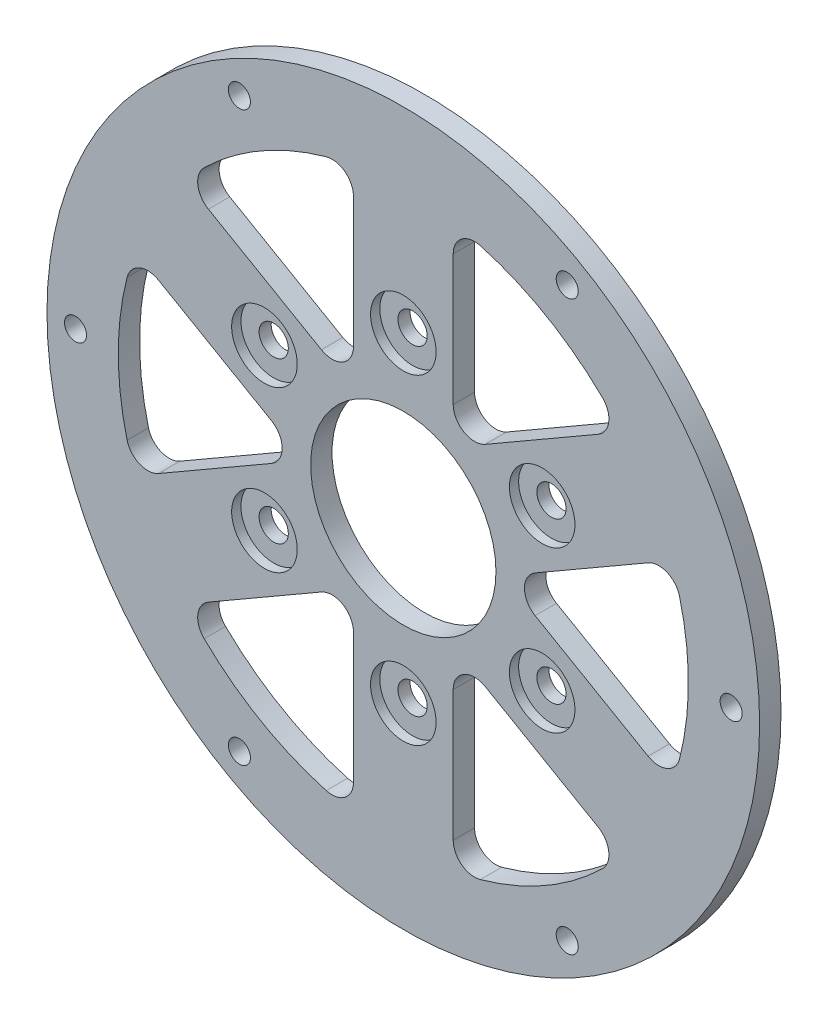
from build123d import *

# Parameters (mm, degrees)
SKETCH_1_R          = 52
SKETCH_1_R_2        = 1.55
SKETCH_1_R_3        = 2.05
SKETCH_1_R_4        = 13
EXTRUDE_1_DEPTH     = 3
FILLET_1_R          = 3
SKETCH_2_R          = 4.6
CUT_EXTRUDE_1_DEPTH = 1.3
SKETCH_3_R          = 68.655116319
SKETCH_3_R_2        = 50
CUT_EXTRUDE_2_DEPTH = 10


with BuildPart() as part:
    # 草图1 → 凸台-拉伸1 (new body)
    with BuildSketch(Plane.XY):
        Circle(SKETCH_1_R)
        with Locations((46, 0)):
            Circle(SKETCH_1_R_2, mode=Mode.SUBTRACT)
        with Locations((23, -39.837168574)):
            Circle(SKETCH_1_R_2, mode=Mode.SUBTRACT)
        with Locations((-23, -39.837168574)):
            Circle(SKETCH_1_R_2, mode=Mode.SUBTRACT)
        with Locations((-46, 0)):
            Circle(SKETCH_1_R_2, mode=Mode.SUBTRACT)
        with Locations((-23, 39.837168574)):
            Circle(SKETCH_1_R_2, mode=Mode.SUBTRACT)
        with Locations((23, 39.837168574)):
            Circle(SKETCH_1_R_2, mode=Mode.SUBTRACT)
        with Locations((0, 22.5)):
            Circle(SKETCH_1_R_3, mode=Mode.SUBTRACT)
        with Locations((19.485571585, 11.25)):
            Circle(SKETCH_1_R_3, mode=Mode.SUBTRACT)
        with Locations((19.485571585, -11.25)):
            Circle(SKETCH_1_R_3, mode=Mode.SUBTRACT)
        with Locations((0, -22.5)):
            Circle(SKETCH_1_R_3, mode=Mode.SUBTRACT)
        with Locations((-19.485571585, -11.25)):
            Circle(SKETCH_1_R_3, mode=Mode.SUBTRACT)
        with Locations((-19.485571585, 11.25)):
            Circle(SKETCH_1_R_3, mode=Mode.SUBTRACT)
        Circle(SKETCH_1_R_4, mode=Mode.SUBTRACT)
        with BuildLine():
            Line((14, 0), (37.606451003, 13.629190841))
            ThreePointArc((37.606451003, 13.629190841), (40, 0), (37.606451003, -13.629190841))
            Line((37.606451003, -13.629190841), (14, 0))
        make_face(mode=Mode.SUBTRACT)
        with BuildLine():
            Line((7, -12.124355653), (7, -39.382737335))
            ThreePointArc((7, -39.382737335), (20, -34.641016151), (30.606451003, -25.753546494))
            Line((30.606451003, -25.753546494), (7, -12.124355653))
        make_face(mode=Mode.SUBTRACT)
        with BuildLine():
            Line((-7, -12.124355653), (-30.606451003, -25.753546494))
            ThreePointArc((-30.606451003, -25.753546494), (-20, -34.641016151), (-7, -39.382737335))
            Line((-7, -39.382737335), (-7, -12.124355653))
        make_face(mode=Mode.SUBTRACT)
        with BuildLine():
            Line((-14, 0), (-37.606451003, 13.629190841))
            ThreePointArc((-37.606451003, 13.629190841), (-40, 0), (-37.606451003, -13.629190841))
            Line((-37.606451003, -13.629190841), (-14, 0))
        make_face(mode=Mode.SUBTRACT)
        with BuildLine():
            Line((-7, 12.124355653), (-7, 39.382737335))
            ThreePointArc((-7, 39.382737335), (-20, 34.641016151), (-30.606451003, 25.753546494))
            Line((-30.606451003, 25.753546494), (-7, 12.124355653))
        make_face(mode=Mode.SUBTRACT)
        with BuildLine():
            Line((7, 12.124355653), (30.606451003, 25.753546494))
            ThreePointArc((30.606451003, 25.753546494), (20, 34.641016151), (7, 39.382737335))
            Line((7, 39.382737335), (7, 12.124355653))
        make_face(mode=Mode.SUBTRACT)
    extrude(amount=EXTRUDE_1_DEPTH)

    # 圆角1
    fillet_1_edges = [part.edges().sort_by_distance(p)[0] for p in [
        (7, 39.382737335, 1.5),
        (7, 12.124355653, 1.5),
        (30.606451003, 25.753546494, 1.5),
        (14, 0, 1.5),
        (37.606451003, -13.629190841, 1.5),
        (37.606451003, 13.629190841, 1.5),
        (30.606451003, -25.753546494, 1.5),
        (7, -12.124355653, 1.5),
        (7, -39.382737335, 1.5),
        (-7, -39.382737335, 1.5),
        (-7, -12.124355653, 1.5),
        (-30.606451003, -25.753546494, 1.5),
        (-37.606451003, -13.629190841, 1.5),
        (-14, 0, 1.5),
        (-37.606451003, 13.629190841, 1.5),
        (-30.606451003, 25.753546494, 1.5),
        (-7, 12.124355653, 1.5),
        (-7, 39.382737335, 1.5),
    ]]
    fillet(fillet_1_edges, radius=FILLET_1_R)

    # 草图2 → 切除-拉伸1 (cut)
    with BuildSketch(Plane.XY.offset(3)):
        with Locations((-19.485571585, 11.25)):
            Circle(SKETCH_2_R)
        with Locations((0, 22.5)):
            Circle(SKETCH_2_R)
        with Locations((19.485571585, 11.25)):
            Circle(SKETCH_2_R)
        with Locations((19.485571585, -11.25)):
            Circle(SKETCH_2_R)
        with Locations((0, -22.5)):
            Circle(SKETCH_2_R)
        with Locations((-19.485571585, -11.25)):
            Circle(SKETCH_2_R)
    extrude(amount=-CUT_EXTRUDE_1_DEPTH, mode=Mode.SUBTRACT)

    # 草图3 → 切除-拉伸2 (cut)
    with BuildSketch(Plane.XY.offset(3)):
        Circle(SKETCH_3_R)
        Circle(SKETCH_3_R_2, mode=Mode.SUBTRACT)
    extrude(amount=-CUT_EXTRUDE_2_DEPTH, mode=Mode.SUBTRACT)


solid = part.part
